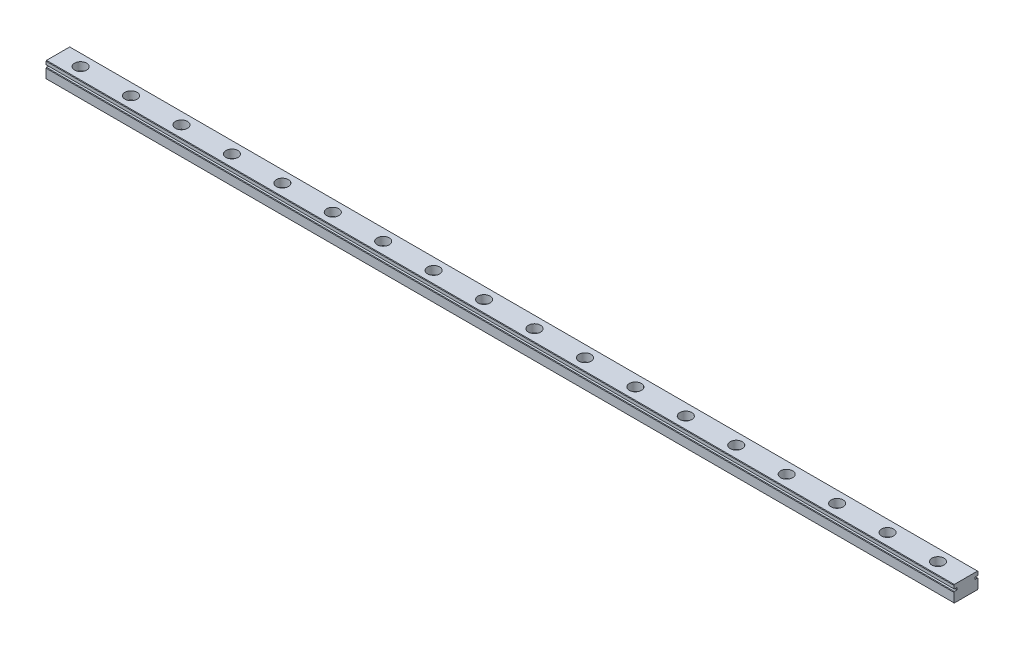
from build123d import *

# Parameters (mm, degrees)
BOSS_EXTRU_1_DEPTH           = 450
CHANFREIN1_SIZE              = 0.25
CHANFREIN1_OF_SYM_TRIE1_SIZE = 0.25
ESQUISSE2_R                  = 3
ENL_V_MAT_EXTRU_1_DEPTH      = 4
ESQUISSE3_R                  = 1.65
ENL_V_MAT_EXTRU_2_DEPTH      = 451.057774069
R_P_TITION_LIN_AIRE1_COUNT   = 18
R_P_TITION_LIN_AIRE1_PITCH   = 25


with BuildPart() as part:
    # Esquisse1 → Boss.-Extru.1 (new body)
    with BuildSketch(Plane(origin=(0, 0, 0), x_dir=(0, 0, -1), z_dir=(1, 0, 0))):
        Polygon((6, 5), (6, 0), (0, 0), (0, 8), (6, 8), (6, 6), (4.4, 6), (4.4, 5), align=None)
    boss_extru_1 = extrude(amount=BOSS_EXTRU_1_DEPTH)

    # Chanfrein1
    chanfrein1_edges = [part.edges().sort_by_distance(p)[0] for p in [
        (225, 6, -6),
        (225, 5, -6),
        (225, 0, -6),
        (225, 8, -6),
    ]]
    chamfer(chanfrein1_edges, length=CHANFREIN1_SIZE)

    # Symétrie1: Boss.-Extru.1 across plane
    add(boss_extru_1.mirror(Plane.XY))

    # Chanfrein1 of Symétrie1
    chanfrein1_of_sym_trie1_edges = [part.edges().sort_by_distance(p)[0] for p in [
        (225, 6, 6),
        (225, 5, 6),
        (225, 0, 6),
        (225, 8, 6),
    ]]
    chamfer(chanfrein1_of_sym_trie1_edges, length=CHANFREIN1_OF_SYM_TRIE1_SIZE)

    # Esquisse2 → Enlèv. mat.-Extru.1 (cut)
    with BuildSketch(Plane(origin=(0, 8, 0), x_dir=(1, 0, 0), z_dir=(0, 1, 0))):
        with Locations(Location((11.153483455, 0, 0), (0, 0, 270))):
            Circle(ESQUISSE2_R)
    enl_v_mat_extru_1 = extrude(amount=-ENL_V_MAT_EXTRU_1_DEPTH, mode=Mode.SUBTRACT)

    # Esquisse3 → Enlèv. mat.-Extru.2 (cut, through all)
    with BuildSketch(Plane(origin=(0, 4, 0), x_dir=(1, 0, 0), z_dir=(0, 1, 0))):
        with Locations(Location((11.153483455, 0, 0), (0, 0, 270))):
            Circle(ESQUISSE3_R)
    enl_v_mat_extru_2 = extrude(amount=-ENL_V_MAT_EXTRU_2_DEPTH, mode=Mode.SUBTRACT)

    # Répétition linéaire1: Enlèv. mat.-Extru.1, Enlèv. mat.-Extru.2 ×18
    with Locations(*[(i * R_P_TITION_LIN_AIRE1_PITCH, 0, 0) for i in range(1, R_P_TITION_LIN_AIRE1_COUNT)]):
        add(enl_v_mat_extru_1, mode=Mode.SUBTRACT)
        add(enl_v_mat_extru_2, mode=Mode.SUBTRACT)


solid = part.part
